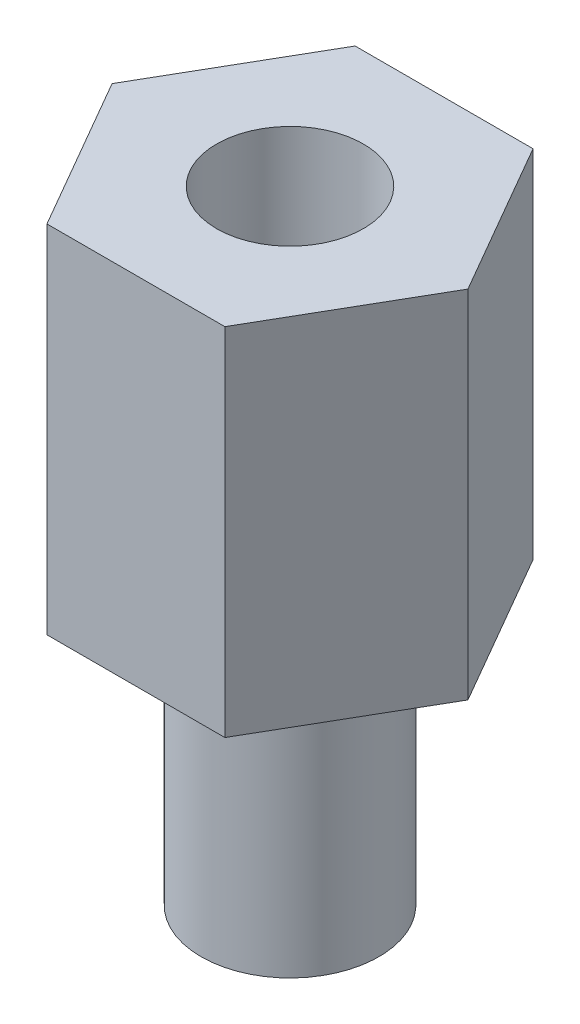
from build123d import *

# Parameters (mm, degrees)
SKETCH1_R                       = 2
BOSS_EXTRUDE1_DEPTH             = 6
BOSS_EXTRUDE2_DEPTH             = 8
TAP_DRILL_FOR_M4X0_7_TAP1_D     = 3.3
TAP_DRILL_FOR_M4X0_7_TAP1_DEPTH = 7
TAP_DRILL_FOR_M4X0_7_TAP1_TIP   = 0.991420021


with BuildPart() as part:
    # Sketch1 → Boss-Extrude1 (new body)
    with BuildSketch(Plane(origin=(0, 0, 0), x_dir=(1, 0, 0), z_dir=(0, 1, 0))):
        with Locations(Location((0, 0, 0), (0, 0, 270))):
            Circle(SKETCH1_R)
    extrude(amount=-BOSS_EXTRUDE1_DEPTH)

    # Sketch2 → Boss-Extrude2 (add)
    with BuildSketch(Plane(origin=(0, 0, 0), x_dir=(1, 0, 0), z_dir=(0, 1, 0))):
        Polygon((4, 0), (2, 3.464101615), (-2, 3.464101615), (-4, 0), (-2, -3.464101615), (2, -3.464101615), align=None)
    extrude(amount=BOSS_EXTRUDE2_DEPTH)

    # Tap Drill for M4x0.7 Tap1
    with Locations(Plane(origin=(0, 8, 0), x_dir=(1, 0, 0), z_dir=(0, 1, 0))):
        with Locations((0, 0)):
            Hole(TAP_DRILL_FOR_M4X0_7_TAP1_D / 2, depth=TAP_DRILL_FOR_M4X0_7_TAP1_DEPTH)
            with Locations((0, 0, -(TAP_DRILL_FOR_M4X0_7_TAP1_DEPTH + TAP_DRILL_FOR_M4X0_7_TAP1_TIP / 2))):  # 118° drill point
                Cone(0, TAP_DRILL_FOR_M4X0_7_TAP1_D / 2, TAP_DRILL_FOR_M4X0_7_TAP1_TIP, mode=Mode.SUBTRACT)


solid = part.part
